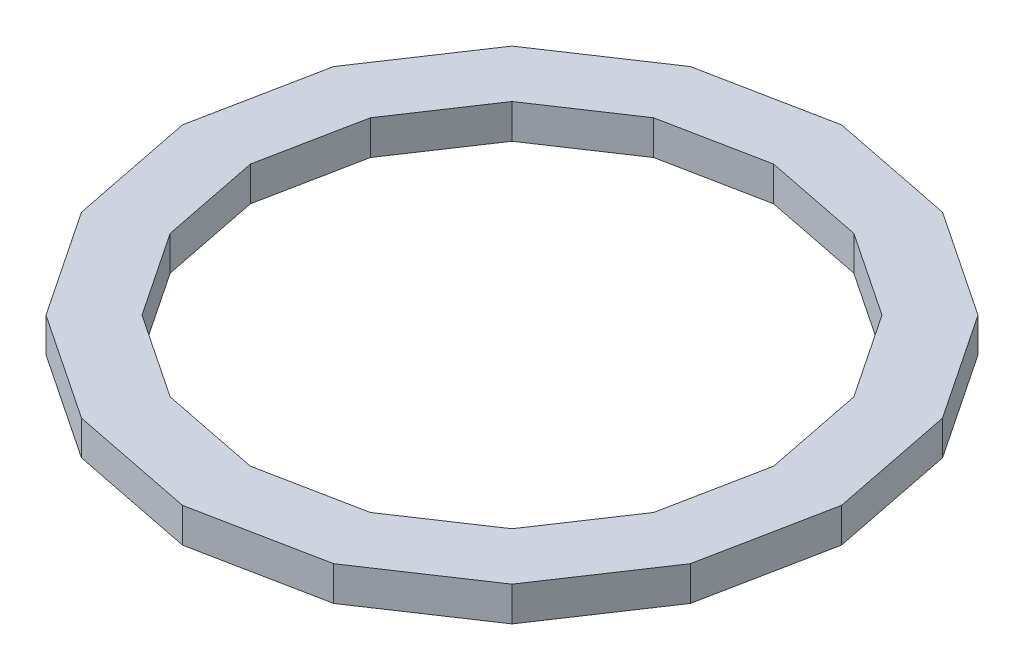
from build123d import *

# Parameters (mm, degrees)
BOSS_EXTRUDE1_DEPTH = 19.05


with BuildPart() as part:
    # Sketch1 → Boss-Extrude1 (new body)
    with BuildSketch(Plane(origin=(0, 0, 0), x_dir=(1, 0, 0), z_dir=(0, 1, 0))):
        Polygon((182.274546643, 0), (168.399722942, 69.753449142), (128.887567969, 128.887567969), (69.753449142, 168.399722942), (0, 182.274546643), (-69.753449142, 168.399722942), (-128.887567969, 128.887567969), (-168.399722942, 69.753449142), (-182.274546643, 0), (-168.399722942, -69.753449142), (-128.887567969, -128.887567969), (-69.753449142, -168.399722942), (0, -182.274546643), (69.753449142, -168.399722942), (128.887567969, -128.887567969), (168.399722942, -69.753449142), align=None)
        Polygon((144.723004287, 0), (133.706621544, 55.383096023), (102.334617725, 102.334617725), (55.383096023, 133.706621544), (0, 144.723004287), (-55.383096023, 133.706621544), (-102.334617725, 102.334617725), (-133.706621544, 55.383096023), (-144.723004287, 0), (-133.706621544, -55.383096023), (-102.334617725, -102.334617725), (-55.383096023, -133.706621544), (0, -144.723004287), (55.383096023, -133.706621544), (102.334617725, -102.334617725), (133.706621544, -55.383096023), align=None, mode=Mode.SUBTRACT)
    extrude(amount=BOSS_EXTRUDE1_DEPTH)


solid = part.part
